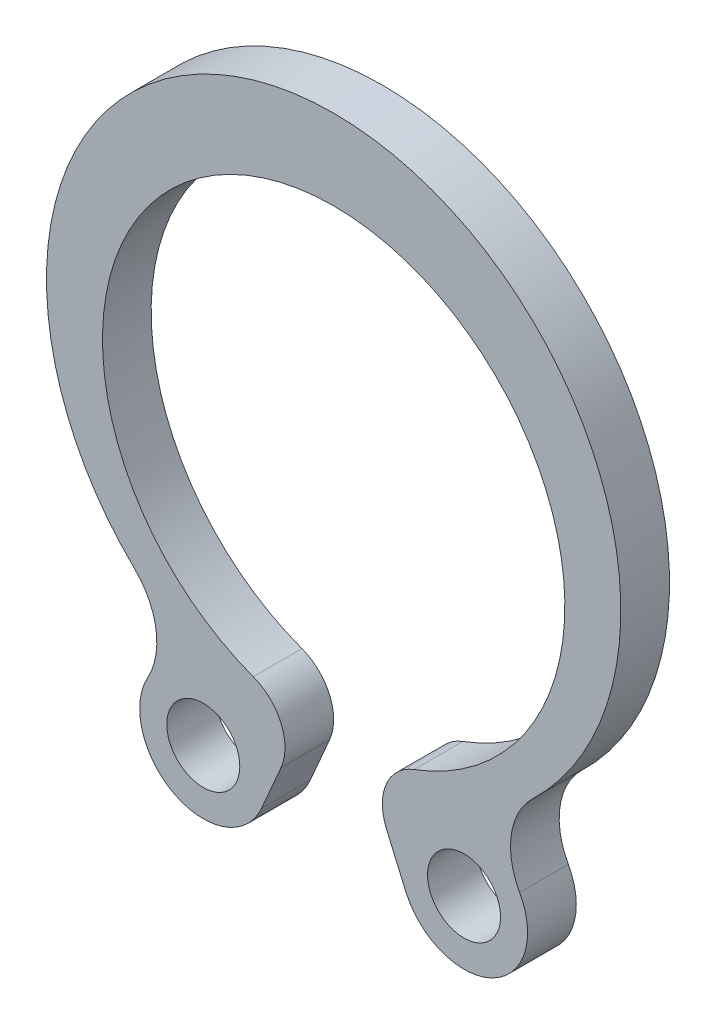
from build123d import *

# Parameters (mm, degrees)
SKETCH1_R  = 0.75
BODY_DEPTH = 1


with BuildPart() as part:
    # Sketch1 → Body (new body)
    with BuildSketch(Plane.XY):
        with BuildLine():
            Line((1.082266202, -5.78816068), (1.480389829, -6.708037752))
            ThreePointArc((1.480389829, -6.708037752), (3.255095183, -7.361114983), (3.821090052, -5.556748399))
            ThreePointArc((3.821090052, -5.556748399), (3.649965113, -4.607038165), (4.092763633, -3.749621847))
            ThreePointArc((4.092763633, -3.749621847), (0, 6.4), (-4.092763633, -3.749621847))
            ThreePointArc((-4.092763633, -3.749621847), (-3.649965113, -4.607038165), (-3.821090052, -5.556748399))
            ThreePointArc((-3.821090052, -5.556748399), (-3.255095183, -7.361114983), (-1.480389829, -6.708037752))
            Line((-1.480389829, -6.708037752), (-1.082266202, -5.78816068))
            ThreePointArc((-1.082266202, -5.78816068), (-1.080324382, -4.998285713), (-1.652173913, -4.453405591))
            ThreePointArc((-1.652173913, -4.453405591), (0, 4.75), (1.652173913, -4.453405591))
            ThreePointArc((1.652173913, -4.453405591), (1.080324382, -4.998285713), (1.082266202, -5.78816068))
        make_face()
        with Locations((-2.678768543, -6.189378363)):
            Circle(SKETCH1_R, mode=Mode.SUBTRACT)
        with Locations(Location((2.678768543, -6.189378363, 0), (0, 0, 180))):
            Circle(SKETCH1_R, mode=Mode.SUBTRACT)
    extrude(amount=BODY_DEPTH)


solid = part.part
